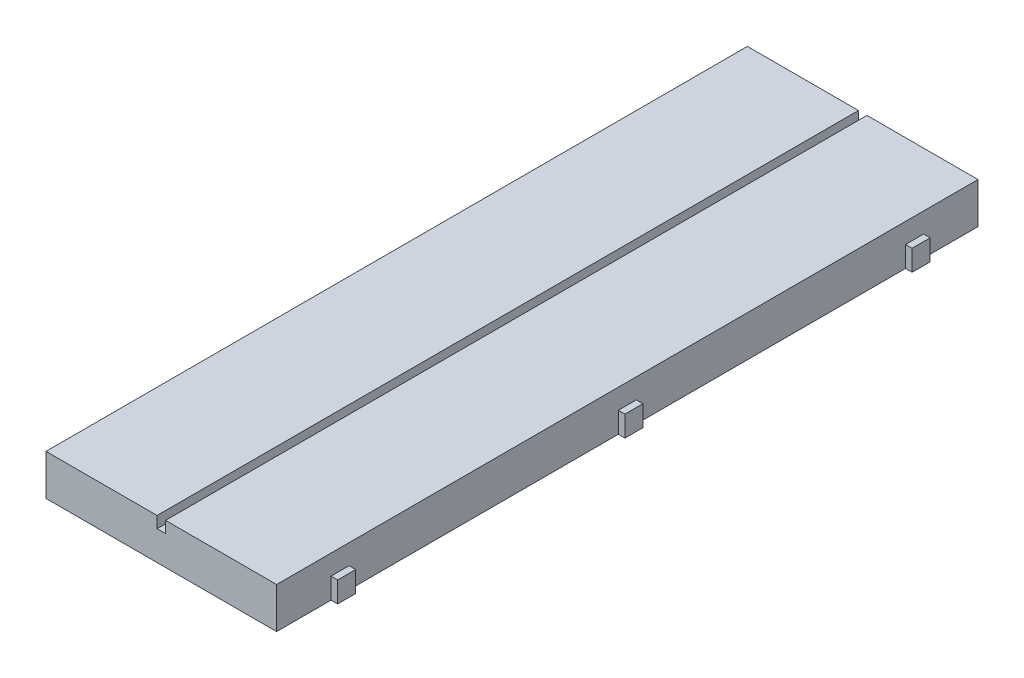
from build123d import *

# Parameters (mm, degrees)
SKETCH1_W                = 54.25
SKETCH1_H                = 165
BOSS_EXTRUDE1_DEPTH      = 9.6
BOSS_EXTRUDE2_DEPTH      = 1.55
BOSS_EXTRUDE2_DEPTH_BACK = 1.55
SKETCH2_W                = 4.25
SKETCH2_H                = 4.9
SKETCH15_W               = 4.25
SKETCH15_H               = 4.9
CUT_EXTRUDE1_DEPTH       = 1.55
SKETCH17_W               = 2
SKETCH17_H               = 165
CUT_EXTRUDE2_DEPTH       = 2.7


with BuildPart() as part:
    # Sketch1 → Boss-Extrude1 (new body)
    with BuildSketch(Plane(origin=(0, 0, 0), x_dir=(1, 0, 0), z_dir=(0, 1, 0))):
        Rectangle(SKETCH1_W, SKETCH1_H)
    extrude(amount=-BOSS_EXTRUDE1_DEPTH)

    # Sketch2 → Boss-Extrude2 (add, two sides: drawn at the far end of the back side and taken through both)
    with BuildSketch(Plane(origin=(27.125, 0, 0), x_dir=(0, 0, -1), z_dir=(1, 0, 0)).offset(-BOSS_EXTRUDE2_DEPTH_BACK)):
        with Locations((-67.575, -7.15)):
            Rectangle(SKETCH2_W, SKETCH2_H)
        with Locations((67.575, -7.15)):
            Rectangle(SKETCH2_W, SKETCH2_H)
        with Locations((0, -7.15)):
            Rectangle(SKETCH2_W, SKETCH2_H)
    extrude(amount=BOSS_EXTRUDE2_DEPTH + BOSS_EXTRUDE2_DEPTH_BACK)

    # Sketch15 → Cut-Extrude1 (cut)
    with BuildSketch(Plane.ZY.offset(27.125)):
        with Locations((67.575, -7.15)):
            Rectangle(SKETCH15_W, SKETCH15_H)
        with Locations((-67.575, -7.15)):
            Rectangle(SKETCH15_W, SKETCH15_H)
        with Locations((0, -7.15)):
            Rectangle(SKETCH15_W, SKETCH15_H)
    extrude(amount=-CUT_EXTRUDE1_DEPTH, mode=Mode.SUBTRACT)

    # Sketch17 → Cut-Extrude2 (cut)
    with BuildSketch(Plane(origin=(0, 0, 0), x_dir=(1, 0, 0), z_dir=(0, 1, 0))):
        Rectangle(SKETCH17_W, SKETCH17_H)
    extrude(amount=-CUT_EXTRUDE2_DEPTH, mode=Mode.SUBTRACT)


solid = part.part
